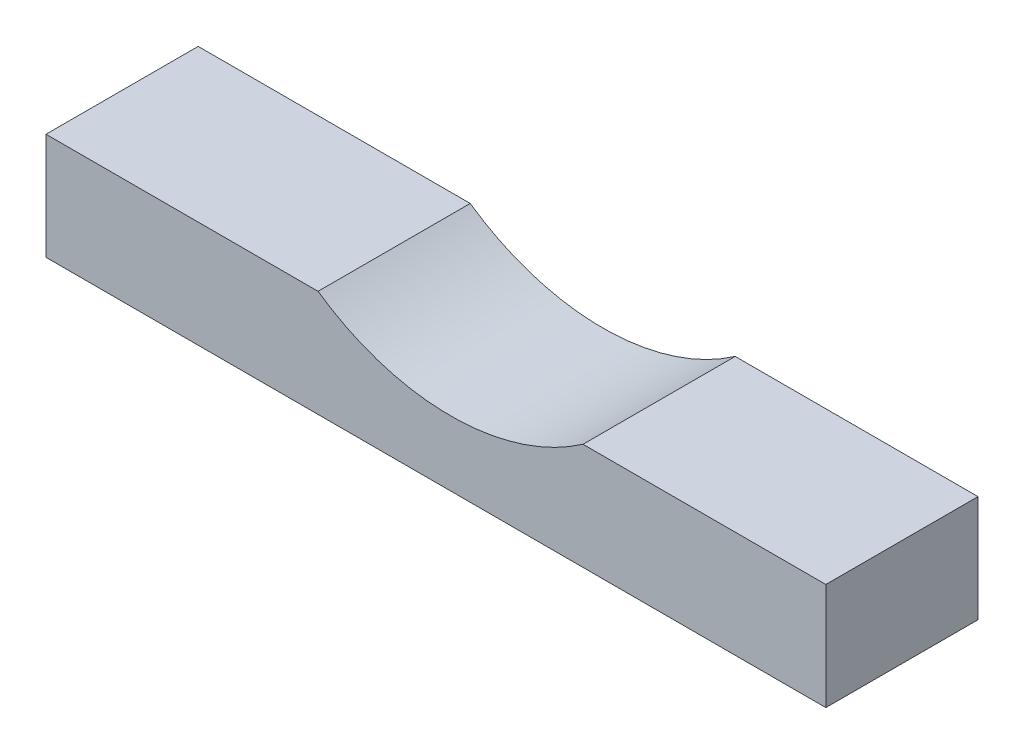
from build123d import *

# Parameters (mm, degrees)
BOSS_EXTRUDE1_DEPTH = 38.1


with BuildPart() as part:
    # Sketch1 → Boss-Extrude1 (new body)
    with BuildSketch(Plane.XY):
        with BuildLine():
            Line((33.170312314, -47.627428872), (93.967860133, -47.627428872))
            Line((93.967860133, -47.627428872), (93.967860133, -74.332818087))
            Line((93.967860133, -74.332818087), (-101.288011779, -74.332818087))
            Line((-101.288011779, -74.332818087), (-101.288011779, -47.627428872))
            Line((-101.288011779, -47.627428872), (-33.170312314, -47.627428872))
            ThreePointArc((-33.170312314, -47.627428872), (0, -58.04), (33.170312314, -47.627428872))
        make_face()
    extrude(amount=-BOSS_EXTRUDE1_DEPTH)


solid = part.part
